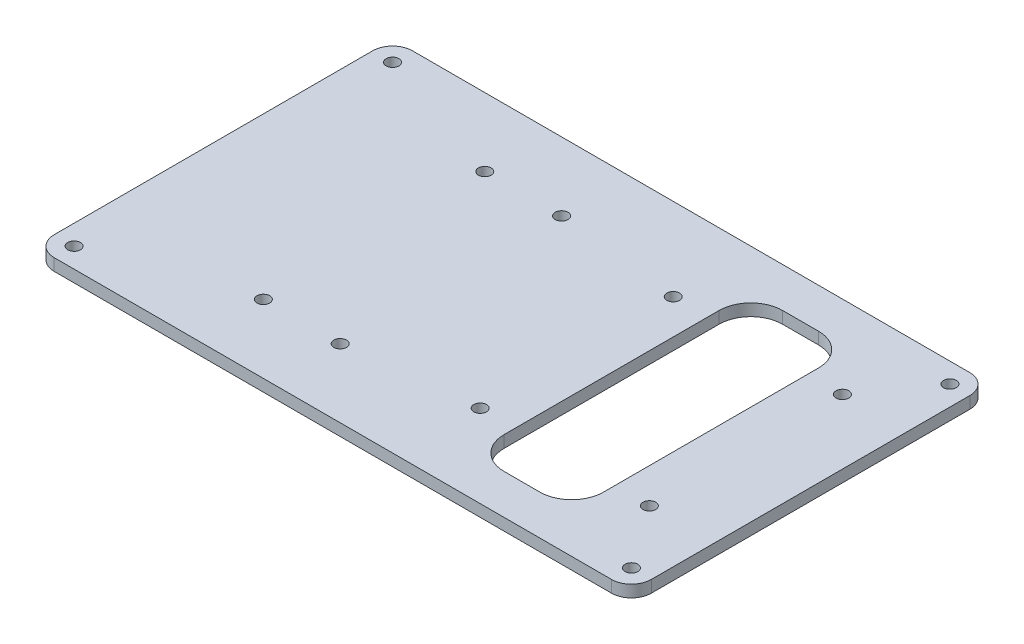
from build123d import *

# Parameters (mm, degrees)
SKETCH1_R           = 1.6
BOSS_EXTRUDE2_DEPTH = 3


with BuildPart() as part:
    # Sketch1 → Boss-Extrude2 (new body)
    with BuildSketch(Plane(origin=(0, 0, 0), x_dir=(1, 0, 0), z_dir=(0, 1, 0))):
        with BuildLine():
            Line((-70, 45), (70, 45))
            ThreePointArc((70, 45), (73.535533906, 43.535533906), (75, 40))
            Line((75, 40), (75, -40))
            ThreePointArc((75, -40), (73.535533906, -43.535533906), (70, -45))
            Line((70, -45), (-70, -45))
            ThreePointArc((-70, -45), (-73.535533906, -43.535533906), (-75, -40))
            Line((-75, -40), (-75, 40))
            ThreePointArc((-75, 40), (-73.535533906, 43.535533906), (-70, 45))
        make_face()
        with Locations(Location((16.25, 24.25, 0), (0, 0, 270))):
            Circle(SKETCH1_R, mode=Mode.SUBTRACT)
        with Locations(Location((58.75, 24.25, 0), (0, 0, 90))):
            Circle(SKETCH1_R, mode=Mode.SUBTRACT)
        with Locations(Location((58.75, -24.25, 0), (0, 0, 270))):
            Circle(SKETCH1_R, mode=Mode.SUBTRACT)
        with Locations(Location((16.25, -24.25, 0), (0, 0, 90))):
            Circle(SKETCH1_R, mode=Mode.SUBTRACT)
        with Locations(Location((-34.65, 27.81, 0), (0, 0, 270))):
            Circle(SKETCH1_R, mode=Mode.SUBTRACT)
        with Locations(Location((-15.35, 27.81, 0), (0, 0, 90))):
            Circle(SKETCH1_R, mode=Mode.SUBTRACT)
        with Locations(Location((-15.35, -27.81, 0), (0, 0, 270))):
            Circle(SKETCH1_R, mode=Mode.SUBTRACT)
        with Locations(Location((-34.65, -27.81, 0), (0, 0, 90))):
            Circle(SKETCH1_R, mode=Mode.SUBTRACT)
        with Locations(Location((-70, 40, 0), (0, 0, 270))):
            Circle(SKETCH1_R, mode=Mode.SUBTRACT)
        with Locations(Location((-70, -40, 0), (0, 0, 90))):
            Circle(SKETCH1_R, mode=Mode.SUBTRACT)
        with Locations(Location((70, 40, 0), (0, 0, 90))):
            Circle(SKETCH1_R, mode=Mode.SUBTRACT)
        with Locations(Location((70, -40, 0), (0, 0, 270))):
            Circle(SKETCH1_R, mode=Mode.SUBTRACT)
        with BuildLine():
            Line((33, 35), (42, 35))
            ThreePointArc((42, 35), (47.656854249, 32.656854249), (50, 27))
            Line((50, 27), (50, -27))
            ThreePointArc((50, -27), (47.656854249, -32.656854249), (42, -35))
            Line((42, -35), (33, -35))
            ThreePointArc((33, -35), (27.343145751, -32.656854249), (25, -27))
            Line((25, -27), (25, 27))
            ThreePointArc((25, 27), (27.343145751, 32.656854249), (33, 35))
        make_face(mode=Mode.SUBTRACT)
    extrude(amount=BOSS_EXTRUDE2_DEPTH)


solid = part.part
